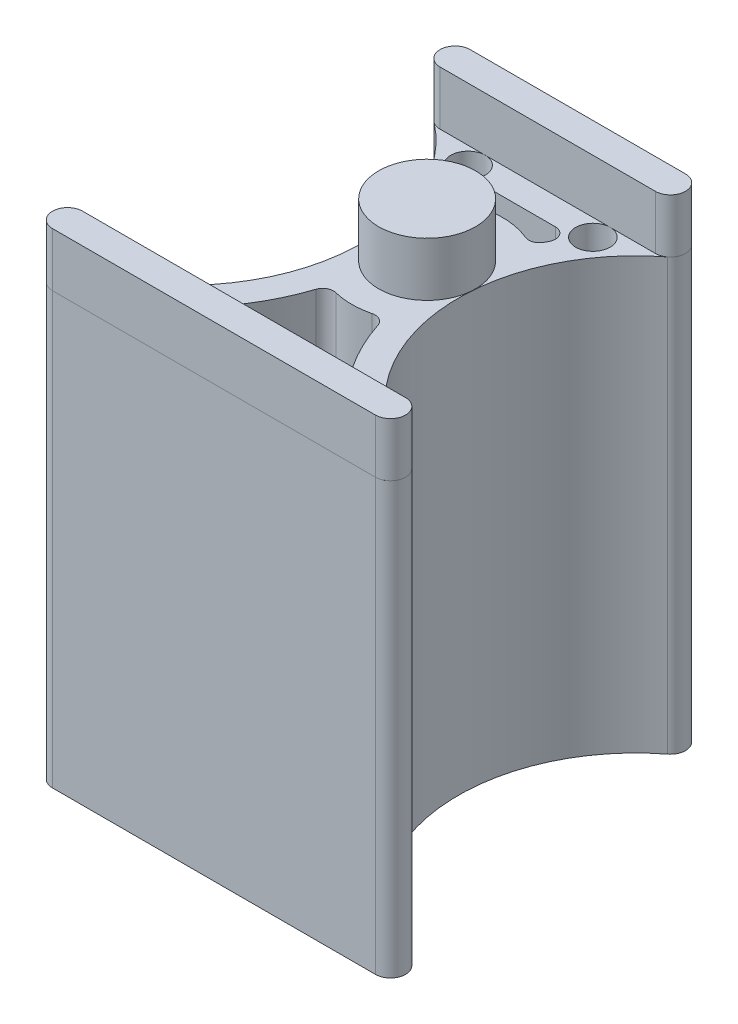
from build123d import *

# Parameters (mm, degrees)
SKETCH1_R             = 4.5
BOSS_EXTRUDE1_DEPTH   = 5
BOSS_EXTRUDE1_2_DEPTH = 5
BOSS_EXTRUDE1_3_DEPTH = 5
BOSS_EXTRUDE2_DEPTH   = 40
CUT_EXTRUDE1_DEPTH    = 48.549973712
FILLET1_R             = 1
CUT_EXTRUDE2_DEPTH    = 48.549973872
FILLET2_R             = 1
SKETCH5_R             = 1.6
CUT_EXTRUDE3_DEPTH    = 48.549973872


with BuildPart() as part:
    # Sketch1 → Boss-Extrude1 (new body)
    with BuildSketch(Plane(origin=(0, 0, 0), x_dir=(1, 0, 0), z_dir=(0, 1, 0))):
        with Locations(Location((0, 0, 0), (0, 0, 270))):
            Circle(SKETCH1_R)
    extrude(amount=BOSS_EXTRUDE1_DEPTH)


with BuildPart() as body_2:
    # Sketch1 → Boss-Extrude1 2 (new body)
    with BuildSketch(Plane(origin=(0, 0, 0), x_dir=(1, 0, 0), z_dir=(0, 1, 0))):
        with BuildLine():
            Line((-10, 14), (10, 14))
            ThreePointArc((10, 14), (11.4, 12.6), (10, 11.2))
            Line((10, 11.2), (-10, 11.2))
            ThreePointArc((-10, 11.2), (-11.4, 12.6), (-10, 14))
        make_face()
    extrude(amount=BOSS_EXTRUDE1_2_DEPTH)


with BuildPart() as body_3:
    # Sketch1 → Boss-Extrude1 3 (new body)
    with BuildSketch(Plane(origin=(0, 0, 0), x_dir=(1, 0, 0), z_dir=(0, 1, 0))):
        with BuildLine():
            Line((-15, -17), (15, -17))
            ThreePointArc((15, -17), (16.4, -18.4), (15, -19.8))
            Line((15, -19.8), (-15, -19.8))
            ThreePointArc((-15, -19.8), (-16.4, -18.4), (-15, -17))
        make_face()
    extrude(amount=BOSS_EXTRUDE1_3_DEPTH)


with BuildPart() as body_4:
    # Sketch2 → Boss-Extrude2 (new body)
    with BuildSketch(Plane.XZ):
        with BuildLine():
            Line((15, 19.8), (-15, 19.8))
            ThreePointArc((-15, 19.8), (-16.380197786, 18.634636041), (-15.462634492, 17.078648674))
            ThreePointArc((-15.462634492, 17.078648674), (-4.654417231, 4.174499379), (-10.840274527, -11.480205948))
            ThreePointArc((-10.840274527, -11.480205948), (-11.328102344, -13.042881658), (-10, -14))
            Line((-10, -14), (10, -14))
            ThreePointArc((10, -14), (11.328102344, -13.042881658), (10.840274527, -11.480205948))
            ThreePointArc((10.840274527, -11.480205948), (4.654417231, 4.174499379), (15.462634492, 17.078648674))
            ThreePointArc((15.462634492, 17.078648674), (16.380197786, 18.634636041), (15, 19.8))
        make_face()
    extrude(amount=BOSS_EXTRUDE2_DEPTH)

    # Sketch3 → Cut-Extrude1 (cut, through all)
    with BuildSketch(Plane(origin=(0, 0, 0), x_dir=(1, 0, 0), z_dir=(0, 1, 0))):
        with BuildLine():
            Line((-7.059953154, -14.5), (7.059953154, -14.5))
            ThreePointArc((7.059953154, -14.5), (4.34028867, -10.772593144), (2.60161457, -6.498584587))
            ThreePointArc((2.60161457, -6.498584587), (0, -7), (-2.60161457, -6.498584587))
            ThreePointArc((-2.60161457, -6.498584587), (-4.34028867, -10.772593144), (-7.059953154, -14.5))
        make_face()
    extrude(amount=-CUT_EXTRUDE1_DEPTH, mode=Mode.SUBTRACT)

    # Fillet1
    fillet1_edges = [body_4.edges().sort_by_distance(p)[0] for p in [
        (-2.60161457, -20, 6.498584587),
        (2.60161457, -20, 6.498584587),
        (7.059953154, -20, 14.5),
        (-7.059953154, -20, 14.5),
    ]]
    fillet(fillet1_edges, radius=FILLET1_R)

    # Sketch4 → Cut-Extrude2 (cut, through all)
    with BuildSketch(Plane(origin=(0, 0, 0), x_dir=(1, 0, 0), z_dir=(0, 1, 0))):
        with BuildLine():
            Line((4.949476545, 8.7), (-4.949476545, 8.7))
            ThreePointArc((-4.949476545, 8.7), (-4.186347115, 7.400983677), (-3.528776397, 6.04547245))
            ThreePointArc((-3.528776397, 6.04547245), (0, 7), (3.528776397, 6.04547245))
            ThreePointArc((3.528776397, 6.04547245), (4.186347115, 7.400983677), (4.949476545, 8.7))
        make_face()
    extrude(amount=-CUT_EXTRUDE2_DEPTH, mode=Mode.SUBTRACT)

    # Fillet2
    fillet2_edges = [body_4.edges().sort_by_distance(p)[0] for p in [
        (3.528776397, -20, -6.04547245),
        (-3.528776397, -20, -6.04547245),
        (-4.949476545, -20, -8.7),
        (4.949476545, -20, -8.7),
    ]]
    fillet(fillet2_edges, radius=FILLET2_R)

    # Sketch5 → Cut-Extrude3 (cut, through all)
    with BuildSketch(Plane(origin=(0, 0, 0), x_dir=(1, 0, 0), z_dir=(0, 1, 0))):
        with Locations(Location((-7.7, -15.4, 0), (0, 0, 270))):
            Circle(SKETCH5_R)
        with Locations(Location((7.7, -15.4, 0), (0, 0, 270))):
            Circle(SKETCH5_R)
        with Locations(Location((-5.8, 9.6, 0), (0, 0, 270))):
            Circle(SKETCH5_R)
        with Locations(Location((5.8, 9.6, 0), (0, 0, 270))):
            Circle(SKETCH5_R)
    extrude(amount=-CUT_EXTRUDE3_DEPTH, mode=Mode.SUBTRACT)


solid = Compound([part.part, body_2.part, body_3.part, body_4.part])
